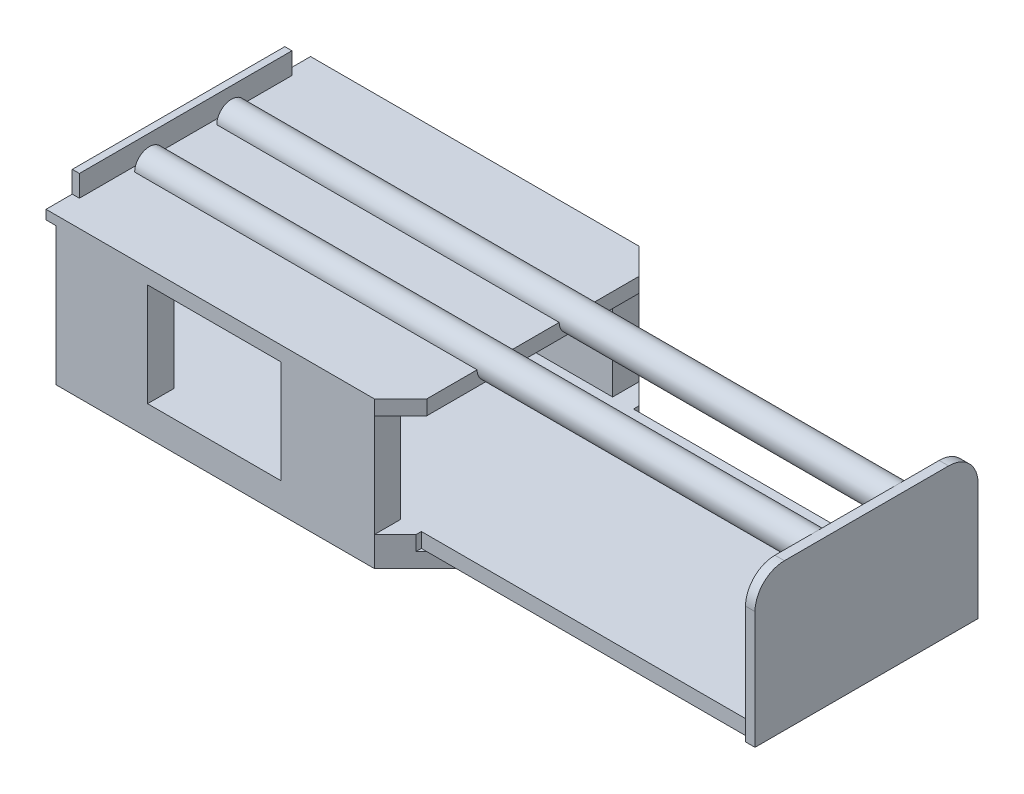
from build123d import *

# Parameters (mm, degrees)
BOSS_EXTRUDE1_DEPTH = 12.7
BOSS_EXTRUDE2_DEPTH = 127
FILLET1_R           = 25.4
FILLET2_R           = 25.4
SKETCH1_5_W         = 80.645440106
SKETCH1_5_H         = 22.674837422
SKETCH1_5_W_2       = 79.142645348
BOSS_EXTRUDE3_DEPTH = 101.6
BOSS_EXTRUDE4_DEPTH = 12.7
BOSS_EXTRUDE5_DEPTH = 12.7
SKETCH5_R           = 12.7
BOSS_EXTRUDE7_DEPTH = 584.2
SKETCH7_W           = 228.6
SKETCH7_H           = 7.952880345
BOSS_EXTRUDE8_DEPTH = 8.636
SKETCH8_W           = 6.162041428
SKETCH8_H           = 183.673914537
BOSS_EXTRUDE9_DEPTH = 18.542


with BuildPart() as part:
    # Sketch1 → Boss-Extrude1 (new body)
    with BuildSketch(Plane(origin=(0, 0, 0), x_dir=(1, 0, 0), z_dir=(0, 1, 0))):
        Polygon((79.142645348, 22.674837422), (79.142645348, 0), (194.415916135, 0), (194.415916135, 22.674837422), (275.061356241, 22.674837422), (275.061356241, 0), (293.021868483, 17.960512242), (293.021868483, 22.674837422), (577.865587161, 22.674837422), (577.865587161, 114.3), (577.865587161, 205.925162578), (293.021868483, 205.925162578), (293.021868483, 210.639487758), (275.061356241, 228.6), (275.061356241, 205.925162578), (194.415916135, 205.925162578), (194.415916135, 228.6), (79.142645348, 228.6), (79.142645348, 205.925162578), (0, 205.925162578), (0, 22.674837422), align=None)
    extrude(amount=BOSS_EXTRUDE1_DEPTH)

    # Sketch1<4> → Boss-Extrude2 (add)
    with BuildSketch(Plane(origin=(0, 0, 0), x_dir=(1, 0, 0), z_dir=(0, 1, 0))):
        Polygon((577.865587161, 22.674837422), (577.865587161, 17.960512242), (586.043736966, 17.960512242), (586.043736966, 22.674837422), (586.043736966, 114.3), (586.043736966, 205.925162578), (586.043736966, 210.639487758), (577.865587161, 210.639487758), (577.865587161, 205.925162578), (577.865587161, 114.3), align=None)
    extrude(amount=BOSS_EXTRUDE2_DEPTH)

    # Fillet1
    fillet1_edges = [part.edges().sort_by_distance(p)[0] for p in [
        (581.954662063, 127, -17.960512242),
    ]]
    fillet(fillet1_edges, radius=FILLET1_R)

    # Fillet2
    fillet2_edges = [part.edges().sort_by_distance(p)[0] for p in [
        (581.954662063, 127, -210.639487758),
    ]]
    fillet(fillet2_edges, radius=FILLET2_R)

    # Sketch1<5> → Boss-Extrude3 (add)
    with BuildSketch(Plane(origin=(0, 0, 0), x_dir=(1, 0, 0), z_dir=(0, 1, 0))):
        with Locations((234.738636188, 217.262581289)):
            Rectangle(SKETCH1_5_W, SKETCH1_5_H)
        with Locations((39.571322674, 217.262581289)):
            Rectangle(SKETCH1_5_W_2, SKETCH1_5_H)
        with Locations((234.738636188, 11.337418711)):
            Rectangle(SKETCH1_5_W, SKETCH1_5_H)
        with Locations((39.571322674, 11.337418711)):
            Rectangle(SKETCH1_5_W_2, SKETCH1_5_H)
    extrude(amount=BOSS_EXTRUDE3_DEPTH)

    # Sketch2 → Boss-Extrude4 (add)
    with BuildSketch(Plane.XZ):
        Polygon((275.061356241, 0), (373.832124936, -98.770768695), (373.832124936, -129.829231305), (275.061356241, -228.6), (0, -228.6), (0, 0), align=None)
    extrude(amount=BOSS_EXTRUDE4_DEPTH)

    # Sketch4 → Boss-Extrude5 (add)
    with BuildSketch(Plane(origin=(0, 101.6, 0), x_dir=(1, 0, 0), z_dir=(0, 1, 0))):
        Polygon((275.061356241, 228.6), (297.736193663, 205.925162578), (297.736193663, 22.674837422), (275.061356241, 0), (0, 0), (0, 228.6), align=None)
    extrude(amount=BOSS_EXTRUDE5_DEPTH)

    # Sketch5 → Boss-Extrude7 (add)
    with BuildSketch(Plane(origin=(586.043736966, 0, 0), x_dir=(0, 0, -1), z_dir=(1, 0, 0))):
        with Locations((78.830256121, 114.3)):
            Circle(SKETCH5_R)
        with Locations((149.769743879, 114.3)):
            Circle(SKETCH5_R)
    extrude(amount=-BOSS_EXTRUDE7_DEPTH)

    # Sketch7 → Boss-Extrude8 (add)
    with BuildSketch(Plane.ZY):
        with Locations((-114.3, 110.323559828)):
            Rectangle(SKETCH7_W, SKETCH7_H)
    extrude(amount=BOSS_EXTRUDE8_DEPTH)

    # Sketch8 → Boss-Extrude9 (add)
    with BuildSketch(Plane(origin=(0, 114.3, 0), x_dir=(1, 0, 0), z_dir=(0, 1, 0))):
        with Locations((-5.554979286, 114.511794691)):
            Rectangle(SKETCH8_W, SKETCH8_H)
    extrude(amount=BOSS_EXTRUDE9_DEPTH)


solid = part.part
